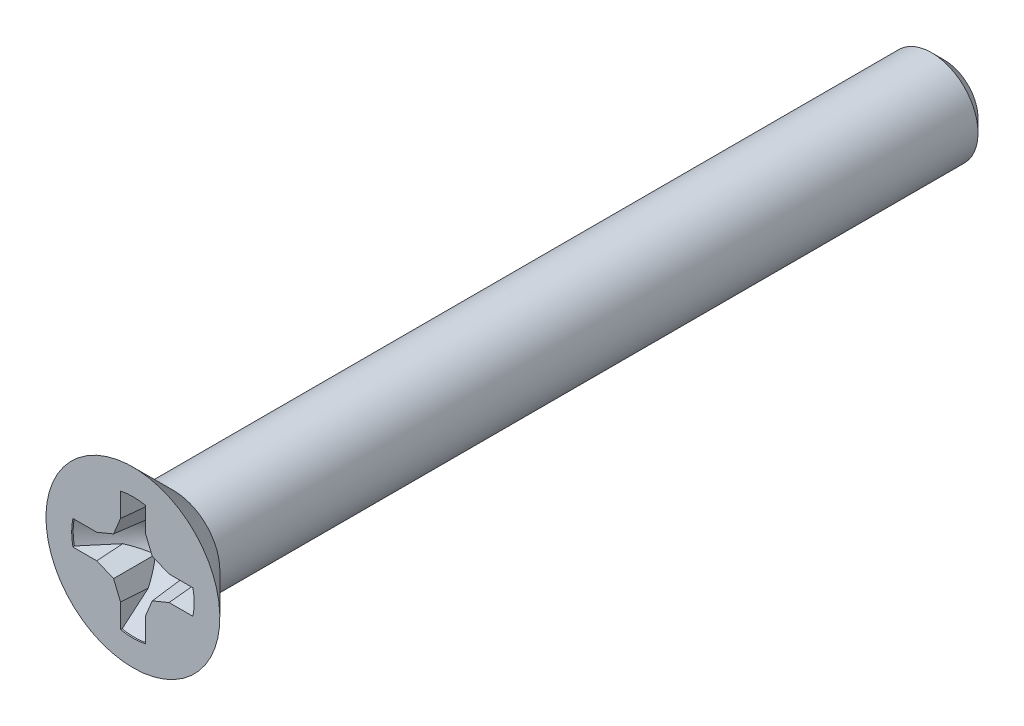
from build123d import *

# Parameters (mm, degrees)
CUT_EXTRUDE1_REACH = 37.4
CIRPATTERN1_COUNT  = 4
DRAFT2_ANGLE       = 5


with BuildPart() as part:
    # Sketch3 → Revolve1 (revolve)
    with BuildSketch(Plane(origin=(0, 0, 0), x_dir=(0, 0, -1), z_dir=(1, 0, 0)), mode=Mode.PRIVATE) as revolve1_sk:
        Polygon((-2.2, 0), (-2.2, 3.75), (-0.45, 2), (-0.45, 0), align=None)
    revolve(revolve1_sk.sketch.rotate(Axis((0, 0, 2.2), (0, 0, -1)), 180), axis=Axis((0, 0, 2.2), (0, 0, -1)))

    # Sketch5 → Revolve2 (revolve)
    with BuildSketch(Plane(origin=(0, 0, 0), x_dir=(0, 0, -1), z_dir=(1, 0, 0))):
        Polygon((32.8, 0), (-0.45, 0), (-0.45, 2), (32.247, 2), (32.8, 1.447), align=None)
    revolve(axis=Axis((0, 0, -32.8), (0, 0, 1)))

    # Cut-Extrude1: up to this cone (the profile starts inside it)
    cut_extrude1_end = Plane(origin=(0, 0, 2.2), z_dir=(0, 0, 1)).offset(-2.704989458) * Cone(1e-06, 43.309980917, 43.309979917, align=(Align.CENTER, Align.CENTER, Align.MIN), mode=Mode.PRIVATE)
    # Sketch4 → Cut-Extrude1 (cut, up to the surface)
    with BuildSketch(Plane.XY.offset(2.2), mode=Mode.PRIVATE) as cut_extrude1_sk1:
        with BuildLine():
            Line((0, 0), (2.6416, 0))
            ThreePointArc((2.6416, 0), (2.627961466, 0.268084114), (2.587186696, 0.5334))
            Line((2.587186696, 0.5334), (1.560293348, 0.5334))
            Line((1.560293348, 0.5334), (0.834170098, 0.834170098))
            Line((0.834170098, 0.834170098), (0.5334, 1.560293348))
            Line((0.5334, 1.560293348), (0.5334, 2.587186696))
            ThreePointArc((0.5334, 2.587186696), (0.268084114, 2.627961466), (0, 2.6416))
            Line((0, 2.6416), (0, 0))
        make_face()
    cut_extrude1_tool1 = extrude(cut_extrude1_sk1.sketch, amount=-CUT_EXTRUDE1_REACH, mode=Mode.PRIVATE) & cut_extrude1_end
    cut_extrude1 = cut_extrude1_tool1.solids().sort_by_distance((0.037358, 1.3208, 2.2))[0]
    add(cut_extrude1, mode=Mode.SUBTRACT)

    # CirPattern1: Cut-Extrude1 ×4 about axis
    cirpattern1_axis = Axis((0, 0, 0), (0, 0, 1))
    for i in range(1, CIRPATTERN1_COUNT):
        add(cut_extrude1.rotate(cirpattern1_axis, i * 360 / CIRPATTERN1_COUNT), mode=Mode.SUBTRACT)

    # Draft2
    draft2_faces = [part.faces().sort_by_distance(p)[0] for p in [
        (-1.92259155, 0.5334, 1.845671202),
        (-1.175407967, 0.692824745, 1.535600175),
        (-0.692824745, 1.175407967, 1.535600175),
        (-0.5334, 1.92259155, 1.845671202),
        (0.5334, 1.92259155, 1.845671202),
        (0.692824745, 1.175407967, 1.535600175),
        (1.175407967, 0.692824745, 1.535600175),
        (1.92259155, 0.5334, 1.845671202),
        (1.92259155, -0.5334, 1.845671202),
        (1.175407967, -0.692824745, 1.535600175),
        (0.692824745, -1.175407967, 1.535600175),
        (0.5334, -1.92259155, 1.845671202),
        (-0.5334, -1.92259155, 1.845671202),
        (-0.692824745, -1.175407967, 1.535600175),
        (-1.175407967, -0.692824745, 1.535600175),
        (-1.92259155, -0.5334, 1.845671202),
    ]]
    draft(draft2_faces, Plane(origin=(0, 0, 2.2), x_dir=(0, 1, 0), z_dir=(0, 0, 1)), DRAFT2_ANGLE)


solid = part.part
